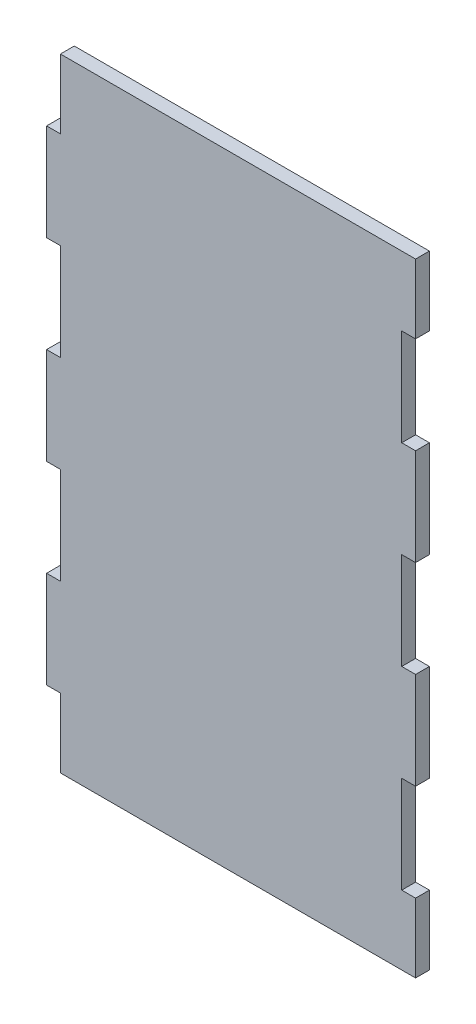
from build123d import *

# Parameters (mm, degrees)
ESBO_O1_W                = 77
ESBO_O1_H                = 135
RESSALTO_EXTRUS_O1_DEPTH = 3
ESBO_O4_W                = 3
ESBO_O4_H                = 21
CORTE_EXTRUS_O1_DEPTH    = 78.765673661
ESBO_O5_W                = 3
ESBO_O5_H                = 21
RESSALTO_EXTRUS_O2_DEPTH = 3
PADR_O_LINEAR1_COUNT     = 3
PADR_O_LINEAR1_PITCH     = 42


with BuildPart() as part:
    # Esboço1 → Ressalto-extrusão1 (new body)
    with BuildSketch(Plane.XY):
        Rectangle(ESBO_O1_W, ESBO_O1_H)
    extrude(amount=RESSALTO_EXTRUS_O1_DEPTH)

    # Esboço4 → Corte-extrusão1 (cut, through all)
    with BuildSketch(Plane.XY.offset(3)):
        with Locations((37, 42)):
            Rectangle(ESBO_O4_W, ESBO_O4_H)
        with Locations((37, 0)):
            Rectangle(ESBO_O4_W, ESBO_O4_H)
        with Locations((37, -42)):
            Rectangle(ESBO_O4_W, ESBO_O4_H)
    extrude(amount=-CORTE_EXTRUS_O1_DEPTH, mode=Mode.SUBTRACT)

    # Esboço5 → Ressalto-extrusão2 (add)
    with BuildSketch(Plane.XY.offset(3)):
        with Locations((-40, 42)):
            Rectangle(ESBO_O5_W, ESBO_O5_H)
    ressalto_extrus_o2 = extrude(amount=-RESSALTO_EXTRUS_O2_DEPTH)

    # Padrão linear1: Ressalto-extrusão2 ×3
    with Locations(*[(0, -i * PADR_O_LINEAR1_PITCH, 0) for i in range(1, PADR_O_LINEAR1_COUNT)]):
        add(ressalto_extrus_o2)


solid = part.part
